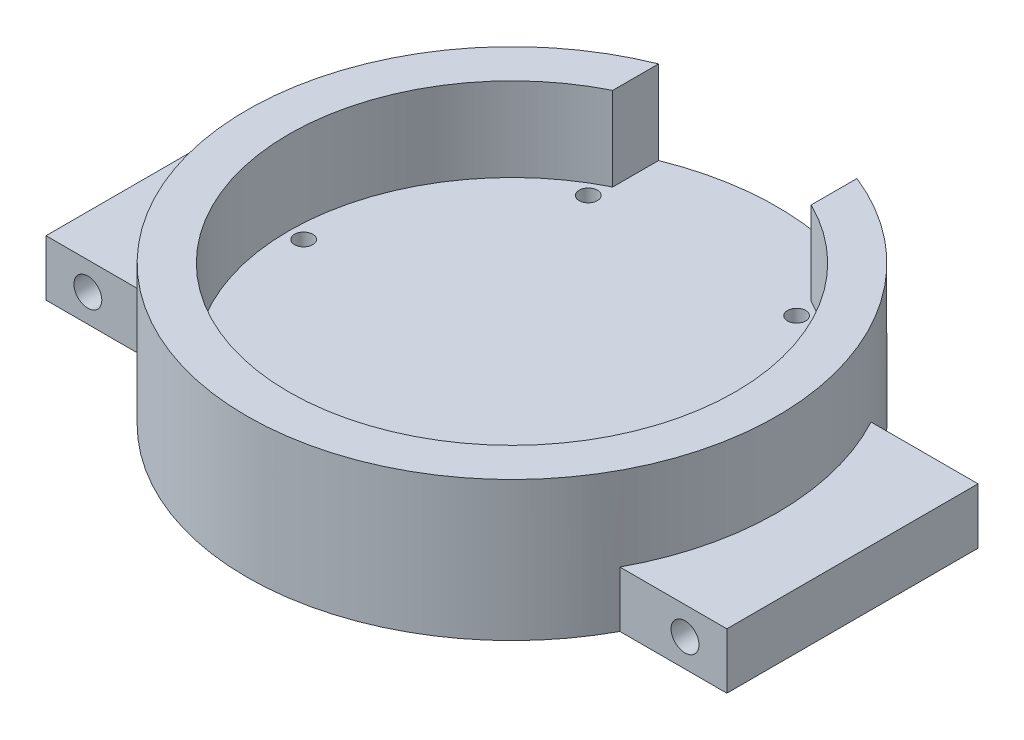
from build123d import *

# Parameters (mm, degrees)
SKETCH7_W                                           = 122
SKETCH7_H                                           = 45
BOSS_EXTRUDE1_DEPTH                                 = 10
SKETCH9_R                                           = 2.5
BOSS_EXTRUDE2_DEPTH                                 = 10
BOSS_EXTRUDE3_START                                 = -25
SKETCH10_R                                          = 40
BOSS_EXTRUDE3_DEPTH                                 = 25
SKETCH11_R                                          = 2.5
CUT_EXTRUDE5_DEPTH                                  = 97.15612305
CUT_EXTRUDE6_DEPTH                                  = 95.053176448
CBORE_FOR_4_BINDING_HEAD_MACHINE_SCREW1_D           = 3.2639
CBORE_FOR_4_BINDING_HEAD_MACHINE_SCREW1_CBORE_D     = 6.74624
CBORE_FOR_4_BINDING_HEAD_MACHINE_SCREW1_CBORE_DEPTH = 1.7272


with BuildPart() as part:
    # Sketch7 → Boss-Extrude1 (new body)
    with BuildSketch(Plane(origin=(0, 0, 0), x_dir=(1, 0, 0), z_dir=(0, 1, 0))):
        with Locations((0, 22.5)):
            Rectangle(SKETCH7_W, SKETCH7_H)
    extrude(amount=BOSS_EXTRUDE1_DEPTH)

    # Sketch9 → Boss-Extrude2 (add)
    # profile 1 of 9: a face of its own
    with BuildSketch(Plane(origin=(0, 10, 0), x_dir=(1, 0, 0), z_dir=(0, 1, 0))):
        with BuildLine():
            ThreePointArc((35.858512086, 0), (40.682190705, 10.793495465), (42.333, 22.5))
            ThreePointArc((42.333, 22.5), (40.682190705, 34.206504535), (35.858512086, 45))
            Line((35.858512086, 45), (-35.858512086, 45))
            ThreePointArc((-35.858512086, 45), (-42.333, 22.5), (-35.858512086, 0))
            Line((-35.858512086, 0), (35.858512086, 0))
        make_face()
        with Locations((37.333, 22.5)):
            Circle(SKETCH9_R, mode=Mode.SUBTRACT)
        with Locations((-37.333, 22.5)):
            Circle(SKETCH9_R, mode=Mode.SUBTRACT)
    # profile 2 of 9: a face of its own
    with BuildSketch(Plane(origin=(0, 10, 0), x_dir=(1, 0, 0), z_dir=(0, 1, 0))):
        with Locations((37.333, 22.5)):
            Circle(SKETCH9_R)
    # profile 3 of 9: a face of its own
    with BuildSketch(Plane(origin=(0, 10, 0), x_dir=(1, 0, 0), z_dir=(0, 1, 0))):
        with Locations((-37.333, 22.5)):
            Circle(SKETCH9_R)
    # profile 4 of 9: a face of its own
    with BuildSketch(Plane(origin=(0, 10, 0), x_dir=(1, 0, 0), z_dir=(0, 1, 0))):
        with BuildLine():
            ThreePointArc((-35.858512086, 0), (0, -19.833), (35.858512086, 0))
            Line((35.858512086, 0), (-35.858512086, 0))
        make_face()
        with Locations((-18.6665, -9.831326399)):
            Circle(SKETCH9_R, mode=Mode.SUBTRACT)
        with Locations((18.6665, -9.831326399)):
            Circle(SKETCH9_R, mode=Mode.SUBTRACT)
    # profile 5 of 9: a face of its own
    with BuildSketch(Plane(origin=(0, 10, 0), x_dir=(1, 0, 0), z_dir=(0, 1, 0))):
        with Locations((18.6665, -9.831326399)):
            Circle(SKETCH9_R)
    # profile 6 of 9: a face of its own
    with BuildSketch(Plane(origin=(0, 10, 0), x_dir=(1, 0, 0), z_dir=(0, 1, 0))):
        with Locations((-18.6665, -9.831326399)):
            Circle(SKETCH9_R)
    # profile 7 of 9: a face of its own
    with BuildSketch(Plane(origin=(0, 10, 0), x_dir=(1, 0, 0), z_dir=(0, 1, 0))):
        with BuildLine():
            Line((-35.858512086, 45), (35.858512086, 45))
            ThreePointArc((35.858512086, 45), (0, 64.833), (-35.858512086, 45))
        make_face()
        with Locations((-18.6665, 54.831326399)):
            Circle(SKETCH9_R, mode=Mode.SUBTRACT)
        with Locations((18.6665, 54.831326399)):
            Circle(SKETCH9_R, mode=Mode.SUBTRACT)
    # profile 8 of 9: a face of its own
    with BuildSketch(Plane(origin=(0, 10, 0), x_dir=(1, 0, 0), z_dir=(0, 1, 0))):
        with Locations((18.6665, 54.831326399)):
            Circle(SKETCH9_R)
    # profile 9 of 9: a face of its own
    with BuildSketch(Plane(origin=(0, 10, 0), x_dir=(1, 0, 0), z_dir=(0, 1, 0))):
        with Locations((-18.6665, 54.831326399)):
            Circle(SKETCH9_R)
    extrude(amount=-BOSS_EXTRUDE2_DEPTH)

    # Sketch10 → Boss-Extrude3 (add)
    # profile 1 of 3: a face of its own
    with BuildSketch(Plane.XZ.offset(BOSS_EXTRUDE3_START)):
        with BuildLine():
            ThreePointArc((-41.833001327, -45), (0, -70), (41.833001327, -45))
            Line((41.833001327, -45), (35.858512086, -45))
            ThreePointArc((35.858512086, -45), (0, -64.833), (-35.858512086, -45))
            Line((-35.858512086, -45), (-41.833001327, -45))
        make_face()
    # profile 2 of 3: a face of its own
    with BuildSketch(Plane.XZ.offset(BOSS_EXTRUDE3_START)):
        with BuildLine():
            ThreePointArc((41.833001327, -45), (46.061467427, -34.101345547), (47.5, -22.5))
            ThreePointArc((47.5, -22.5), (46.061467427, -10.898654453), (41.833001327, 0))
            Line((41.833001327, 0), (35.858512086, 0))
            ThreePointArc((35.858512086, 0), (0, 19.833), (-35.858512086, 0))
            Line((-35.858512086, 0), (-41.833001327, 0))
            ThreePointArc((-41.833001327, 0), (-47.5, -22.5), (-41.833001327, -45))
            Line((-41.833001327, -45), (-35.858512086, -45))
            ThreePointArc((-35.858512086, -45), (0, -64.833), (35.858512086, -45))
            Line((35.858512086, -45), (41.833001327, -45))
        make_face()
        with Locations(Location((0, -22.5, 0), (0, 0, 270))):
            Circle(SKETCH10_R, mode=Mode.SUBTRACT)
    # profile 3 of 3: a face of its own
    with BuildSketch(Plane.XZ.offset(BOSS_EXTRUDE3_START)):
        with BuildLine():
            Line((35.858512086, 0), (41.833001327, 0))
            ThreePointArc((41.833001327, 0), (0, 25), (-41.833001327, 0))
            Line((-41.833001327, 0), (-35.858512086, 0))
            ThreePointArc((-35.858512086, 0), (0, 19.833), (35.858512086, 0))
        make_face()
    extrude(amount=BOSS_EXTRUDE3_DEPTH)

    # Sketch11 → Cut-Extrude5 (cut, through all)
    with BuildSketch(Plane.XY):
        with Locations((-53.5, 5)):
            Circle(SKETCH11_R)
        with Locations((53.5, 5)):
            Circle(SKETCH11_R)
    extrude(amount=-CUT_EXTRUDE5_DEPTH, mode=Mode.SUBTRACT)

    # Sketch12 → Cut-Extrude6 (cut, through all)
    with BuildSketch(Plane(origin=(0, 10, 0), x_dir=(1, 0, 0), z_dir=(0, 1, 0))):
        with BuildLine():
            Line((-17.78, 58.331154042), (-17.78, 66.546811462))
            ThreePointArc((-17.78, 66.546811462), (0, 70), (17.78, 66.546811462))
            Line((17.78, 66.546811462), (17.78, 58.331154042))
            ThreePointArc((17.78, 58.331154042), (0, 62.5), (-17.78, 58.331154042))
        make_face()
    extrude(amount=CUT_EXTRUDE6_DEPTH, mode=Mode.SUBTRACT)

    # CBORE for #4 Binding Head Machine Screw1 (through all)
    with Locations(Plane.XZ):
        with Locations((-18.6665, 9.831326399), (18.6665, 9.831326399), (37.333, -22.5), (18.6665, -54.831326399), (-18.6665, -54.831326399), (-37.333, -22.5)):
            CounterBoreHole(CBORE_FOR_4_BINDING_HEAD_MACHINE_SCREW1_D / 2, CBORE_FOR_4_BINDING_HEAD_MACHINE_SCREW1_CBORE_D / 2, CBORE_FOR_4_BINDING_HEAD_MACHINE_SCREW1_CBORE_DEPTH)


solid = part.part
